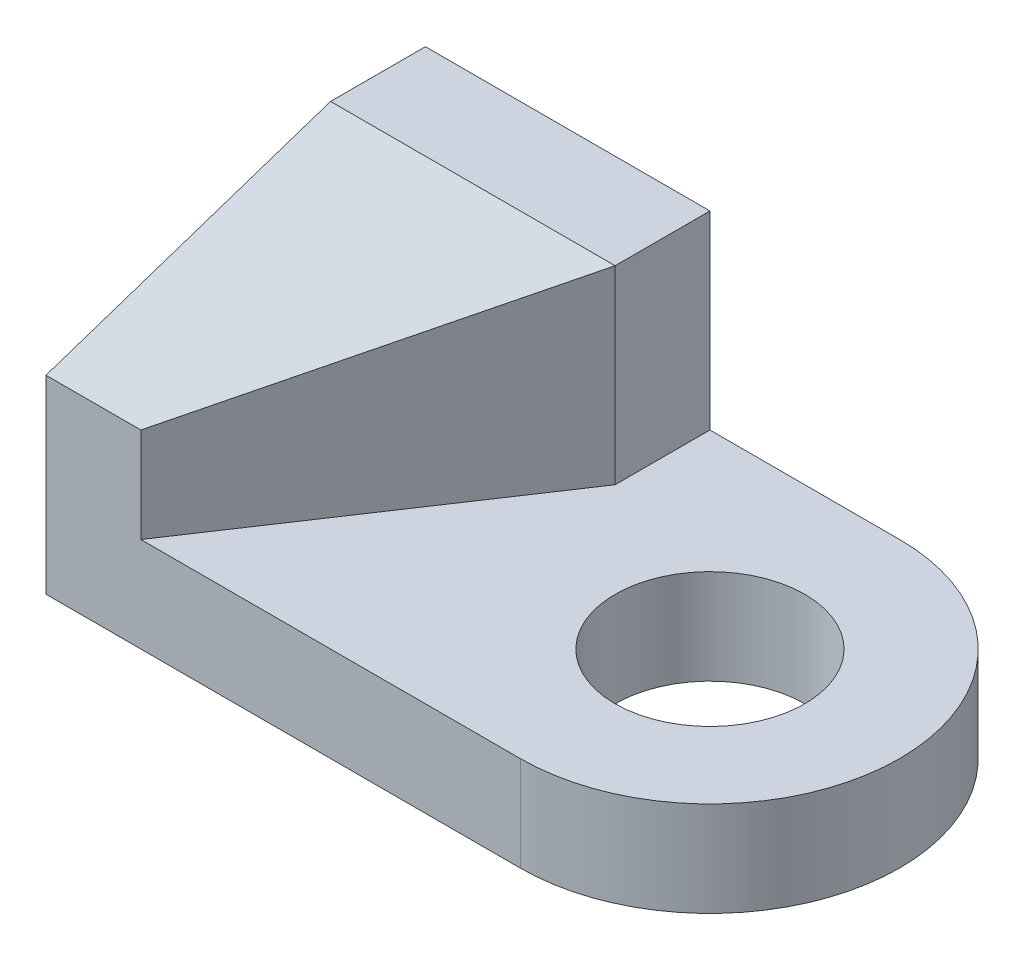
from build123d import *

# Parameters (mm, degrees)
SKETCH_1_R          = 5
EXTRUDE_1_DEPTH     = 5
EXTRUDE_2_DEPTH     = 5
SKETCH_3_W          = 15
SKETCH_3_H          = 5
EXTRUDE_3_DEPTH     = 10
EXTRUDE_4_DEPTH     = 10
CUT_EXTRUDE_1_DEPTH = 22


with BuildPart() as part:
    # 草圖1 → 填料-伸長1 (new body)
    with BuildSketch(Plane(origin=(0, 0, 0), x_dir=(1, 0, 0), z_dir=(0, 1, 0))):
        with BuildLine():
            Line((0, 0), (25, 0))
            ThreePointArc((25, 0), (35, -10), (25, -20))
            Line((25, -20), (0, -20))
            Line((0, -20), (0, 0))
        make_face()
        with Locations(Location((25, -10, 0), (0, 0, 270))):
            Circle(SKETCH_1_R, mode=Mode.SUBTRACT)
    extrude(amount=EXTRUDE_1_DEPTH)

    # 草圖2 → 填料-伸長2 (add)
    with BuildSketch(Plane.ZY):
        Polygon((5, 5), (20, 5), (20, 10), (5, 15), align=None)
    extrude(amount=-EXTRUDE_2_DEPTH)

    # 草圖3 → 填料-伸長3 (add)
    with BuildSketch(Plane(origin=(0, 5, 0), x_dir=(1, 0, 0), z_dir=(0, 1, 0))):
        with Locations((7.5, -2.5)):
            Rectangle(SKETCH_3_W, SKETCH_3_H)
    extrude(amount=EXTRUDE_3_DEPTH)

    # 草圖4 → 填料-伸長4 (add)
    with BuildSketch(Plane(origin=(0, 5, 0), x_dir=(1, 0, 0), z_dir=(0, 1, 0))):
        Polygon((5, -20), (0, -20), (0, -5), (5, -5), (15, -5), align=None)
    extrude(amount=EXTRUDE_4_DEPTH)

    # 草圖5 → 除料-伸長1 (cut)
    with BuildSketch(Plane.ZY):
        Polygon((5, 15), (20, 10), (20, 15), align=None)
    extrude(amount=-CUT_EXTRUDE_1_DEPTH, mode=Mode.SUBTRACT)


solid = part.part
